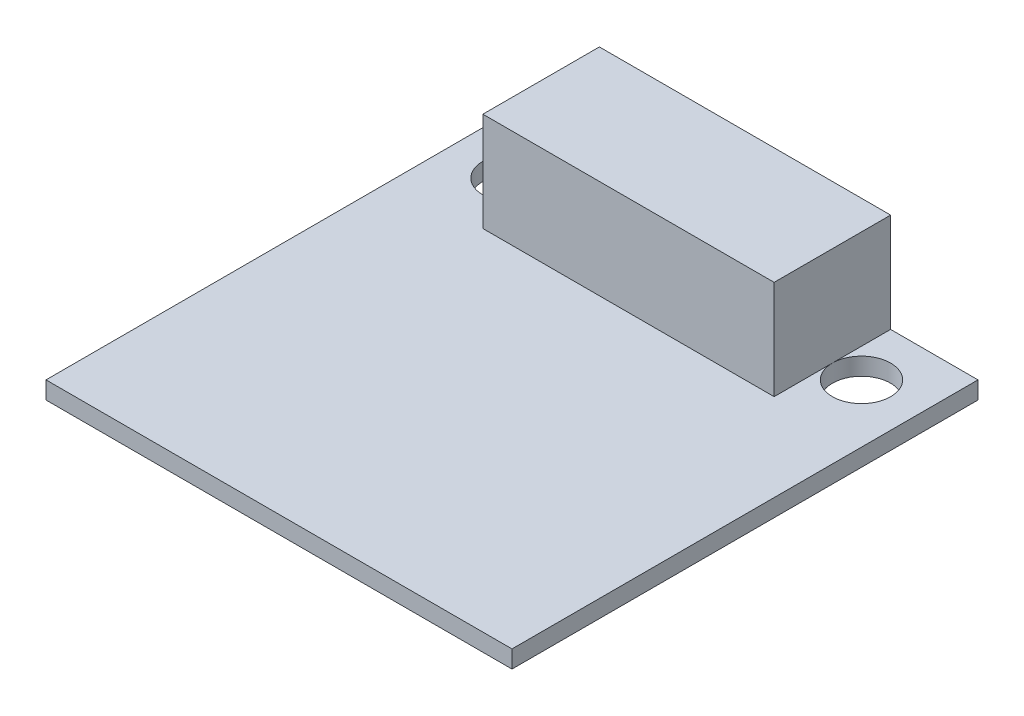
from build123d import *

# Parameters (mm, degrees)
SKETCH1_W           = 80
SKETCH1_H           = 80
SKETCH1_R           = 5
BOSS_EXTRUDE2_DEPTH = 3
BOSS_EXTRUDE3_DEPTH = 20
SCALE2_SCALE        = 0.1


with BuildPart() as part:
    # Sketch1 → Boss-Extrude2 (new body)
    with BuildSketch(Plane(origin=(0, 0, 0), x_dir=(1, 0, 0), z_dir=(0, 1, 0))):
        Rectangle(SKETCH1_W, SKETCH1_H)
        with Locations((-30, 30)):
            Circle(SKETCH1_R, mode=Mode.SUBTRACT)
        with Locations((30, 30)):
            Circle(SKETCH1_R, mode=Mode.SUBTRACT)
    extrude(amount=BOSS_EXTRUDE2_DEPTH)

    # Sketch1<5> → Boss-Extrude3 (add)
    with BuildSketch(Plane(origin=(0, 0, 0), x_dir=(1, 0, 0), z_dir=(0, 1, 0))):
        Polygon((25, 40), (-25, 40), (-25, 30), (-25, 20), (25, 20), (25, 30), align=None)
    extrude(amount=BOSS_EXTRUDE3_DEPTH)


with BuildPart() as part_1:
    # Scale2: scaled about (0, 6.258071502, -13.878534205)
    add(part.part.scale(SCALE2_SCALE).moved(Location((0, 5.632264352, -12.490680785))))


solid = part_1.part
